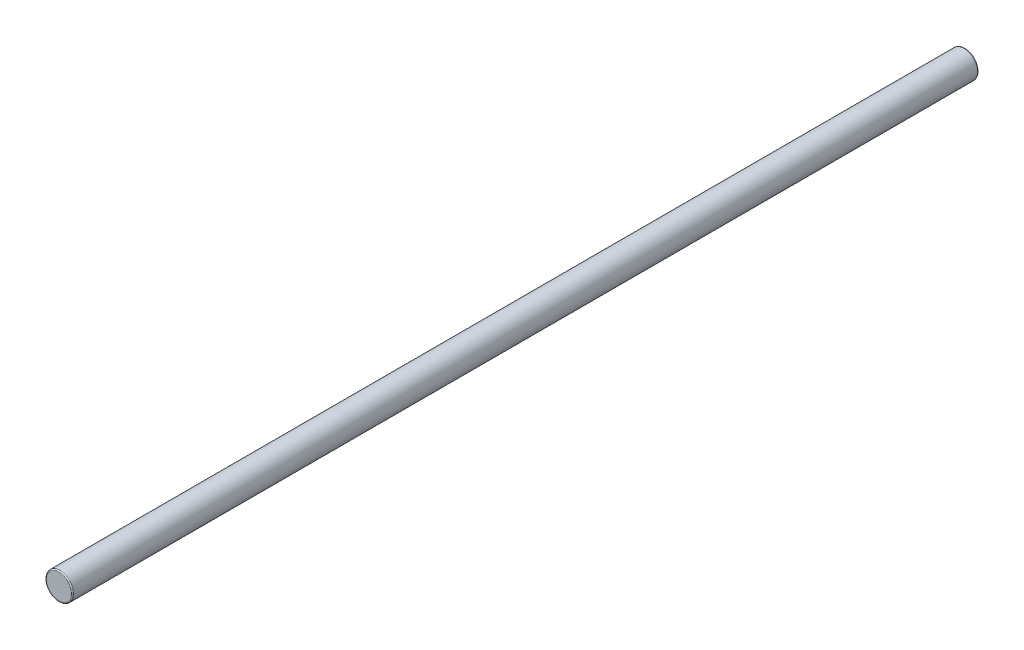
from build123d import *

# Parameters (mm, degrees)
CROQUIS1_R              = 6
SALIENTE_EXTRUIR1_DEPTH = 400
REDONDEO1_R             = 0.5


with BuildPart() as part:
    # Croquis1 → Saliente-Extruir1 (new body)
    with BuildSketch(Plane.XY):
        Circle(CROQUIS1_R)
    extrude(amount=SALIENTE_EXTRUIR1_DEPTH)

    # Redondeo1
    redondeo1_edges = [part.edges().sort_by_distance(p)[0] for p in [
        (-6, 0, 0),
        (-6, 0, 400),
    ]]
    fillet(redondeo1_edges, radius=REDONDEO1_R)


solid = part.part
